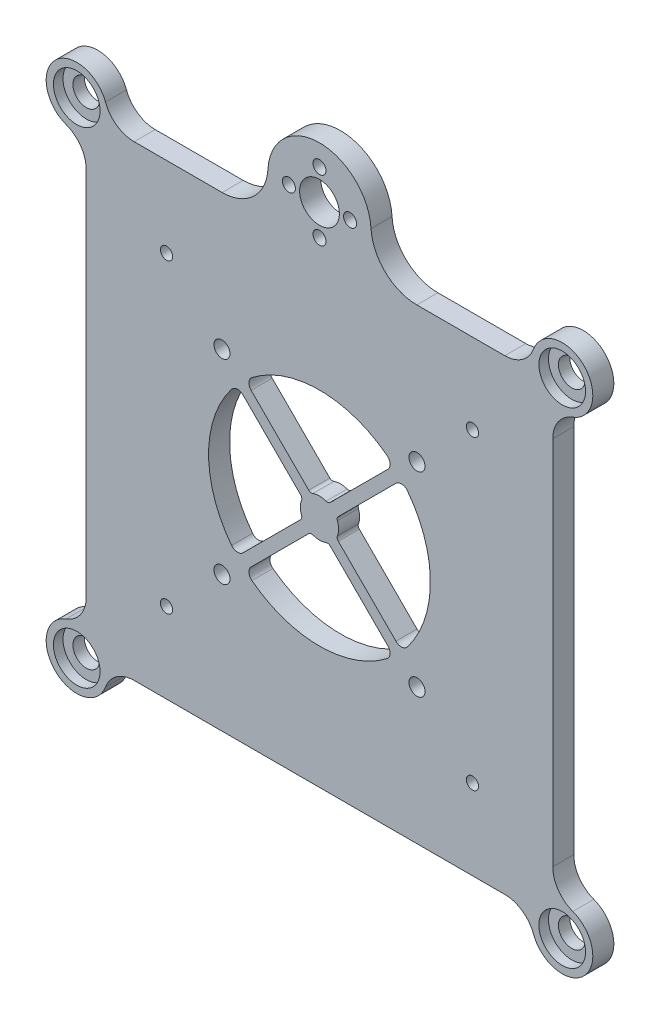
from build123d import *

# Parameters (mm, degrees)
EXTRUDE_1_DEPTH     = 5.5
SKETCH_2_R          = 6.1
CUT_EXTRUDE_1_DEPTH = 2.5
SKETCH_3_R          = 3.5
CUT_EXTRUDE_2_DEPTH = 3
SKETCH_4_R          = 1.7
CUT_EXTRUDE_3_DEPTH = 5.5
SKETCH_5_R          = 5.2
CUT_EXTRUDE_4_DEPTH = 5.5
SKETCH_6_R          = 1.6
SKETCH_6_R_2        = 2.1
CUT_EXTRUDE_5_DEPTH = 5.5
CUT_EXTRUDE_6_DEPTH = 10


with BuildPart() as part:
    # 草图1 → 凸台-拉伸1 (new body)
    with BuildSketch(Plane.XY):
        with BuildLine():
            Line((-48.459116019, -61), (48.459116019, -61))
            ThreePointArc((48.459116019, -61), (53.03620543, -62.438730875), (55.966994877, -66.237436867))
            ThreePointArc((55.966994877, -66.237436867), (69.131727984, -69.131727984), (66.237436867, -55.966994877))
            ThreePointArc((66.237436867, -55.966994877), (62.438730875, -53.03620543), (61, -48.459116019))
            Line((61, -48.459116019), (61, 48.459116019))
            ThreePointArc((61, 48.459116019), (62.438730875, 53.03620543), (66.237436867, 55.966994877))
            ThreePointArc((66.237436867, 55.966994877), (69.131727984, 69.131727984), (55.966994877, 66.237436867))
            ThreePointArc((55.966994877, 66.237436867), (53.03620543, 62.438730875), (48.459116019, 61))
            Line((48.459116019, 61), (25.455844123, 61))
            ThreePointArc((25.455844123, 61), (17.223912036, 64.268717499), (13.476623359, 72.294117647))
            ThreePointArc((13.476623359, 72.294117647), (0, 85), (-13.476623359, 72.294117647))
            ThreePointArc((-13.476623359, 72.294117647), (-17.223912036, 64.268717499), (-25.455844123, 61))
            Line((-25.455844123, 61), (-48.459116019, 61))
            ThreePointArc((-48.459116019, 61), (-53.03620543, 62.438730875), (-55.966994877, 66.237436867))
            ThreePointArc((-55.966994877, 66.237436867), (-69.131727984, 69.131727984), (-66.237436867, 55.966994877))
            ThreePointArc((-66.237436867, 55.966994877), (-62.438730875, 53.03620543), (-61, 48.459116019))
            Line((-61, 48.459116019), (-61, -48.459116019))
            ThreePointArc((-61, -48.459116019), (-62.438730875, -53.03620543), (-66.237436867, -55.966994877))
            ThreePointArc((-66.237436867, -55.966994877), (-69.131727984, -69.131727984), (-55.966994877, -66.237436867))
            ThreePointArc((-55.966994877, -66.237436867), (-53.03620543, -62.438730875), (-48.459116019, -61))
        make_face()
    extrude(amount=-EXTRUDE_1_DEPTH)

    # 草图2 → 切除-拉伸1 (cut)
    with BuildSketch(Plane.XY):
        with Locations((-63.474873734, 63.474873734)):
            Circle(SKETCH_2_R)
        with Locations((63.474873734, 63.474873734)):
            Circle(SKETCH_2_R)
        with Locations((63.474873734, -63.474873734)):
            Circle(SKETCH_2_R)
        with Locations((-63.474873734, -63.474873734)):
            Circle(SKETCH_2_R)
    extrude(amount=-CUT_EXTRUDE_1_DEPTH, mode=Mode.SUBTRACT)

    # 草图3 → 切除-拉伸2 (cut)
    with BuildSketch(Plane.XY.offset(-2.5)):
        with Locations((-63.474873734, 63.474873734)):
            Circle(SKETCH_3_R)
        with Locations((63.474873734, 63.474873734)):
            Circle(SKETCH_3_R)
        with Locations((-63.474873734, -63.474873734)):
            Circle(SKETCH_3_R)
        with Locations((63.474873734, -63.474873734)):
            Circle(SKETCH_3_R)
    extrude(amount=-CUT_EXTRUDE_2_DEPTH, mode=Mode.SUBTRACT)

    # 草图4 → 切除-拉伸3 (cut)
    with BuildSketch(Plane.XY):
        with Locations((8, 71.5)):
            Circle(SKETCH_4_R)
        with Locations((0, 79.5)):
            Circle(SKETCH_4_R)
        with Locations((-8, 71.5)):
            Circle(SKETCH_4_R)
        with Locations((0, 63.5)):
            Circle(SKETCH_4_R)
    extrude(amount=-CUT_EXTRUDE_3_DEPTH, mode=Mode.SUBTRACT)

    # 草图5 → 切除-拉伸4 (cut)
    with BuildSketch(Plane.XY):
        with Locations((0, 71.5)):
            Circle(SKETCH_5_R)
    extrude(amount=-CUT_EXTRUDE_4_DEPTH, mode=Mode.SUBTRACT)

    # 草图6 → 切除-拉伸5 (cut)
    with BuildSketch(Plane.XY):
        with Locations((-40, 40)):
            Circle(SKETCH_6_R)
        with Locations((40, 40)):
            Circle(SKETCH_6_R)
        with Locations((40, -40)):
            Circle(SKETCH_6_R)
        with Locations((-40, -40)):
            Circle(SKETCH_6_R)
        with Locations((-25.5, 25.5)):
            Circle(SKETCH_6_R_2)
        with Locations((25.5, 25.5)):
            Circle(SKETCH_6_R_2)
        with Locations((25.5, -25.5)):
            Circle(SKETCH_6_R_2)
        with Locations((-25.5, -25.5)):
            Circle(SKETCH_6_R_2)
    extrude(amount=-CUT_EXTRUDE_5_DEPTH, mode=Mode.SUBTRACT)

    # 草图8 → 切除-拉伸6 (cut)
    with BuildSketch(Plane.XY):
        with BuildLine():
            Line((4.917472327, 2.796151983), (19.991455189, 17.870134846))
            ThreePointArc((19.991455189, 17.870134846), (21.535572688, 18.451698066), (22.991273845, 17.674878416))
            ThreePointArc((22.991273845, 17.674878416), (29, 0), (22.991273845, -17.674878416))
            ThreePointArc((22.991273845, -17.674878416), (21.535572688, -18.451698066), (19.991455189, -17.870134846))
            Line((19.991455189, -17.870134846), (4.917472327, -2.796151983))
            ThreePointArc((4.917472327, -2.796151983), (4.647578764, -2.30228293), (4.687149257, -1.740871002))
            ThreePointArc((4.687149257, -1.740871002), (5, 0), (4.687149257, 1.740871002))
            ThreePointArc((4.687149257, 1.740871002), (4.647578764, 2.30228293), (4.917472327, 2.796151983))
        make_face()
        with BuildLine():
            Line((2.796151983, 4.917472327), (17.870134846, 19.991455189))
            ThreePointArc((17.870134846, 19.991455189), (18.451698066, 21.535572688), (17.674878416, 22.991273845))
            ThreePointArc((17.674878416, 22.991273845), (0, 29), (-17.674878416, 22.991273845))
            ThreePointArc((-17.674878416, 22.991273845), (-18.451698066, 21.535572688), (-17.870134846, 19.991455189))
            Line((-17.870134846, 19.991455189), (-2.796151983, 4.917472327))
            ThreePointArc((-2.796151983, 4.917472327), (-2.30228293, 4.647578764), (-1.740871002, 4.687149257))
            ThreePointArc((-1.740871002, 4.687149257), (0, 5), (1.740871002, 4.687149257))
            ThreePointArc((1.740871002, 4.687149257), (2.30228293, 4.647578764), (2.796151983, 4.917472327))
        make_face()
        with BuildLine():
            Line((-4.917472327, 2.796151983), (-19.991455189, 17.870134846))
            ThreePointArc((-19.991455189, 17.870134846), (-21.535572688, 18.451698066), (-22.991273845, 17.674878416))
            ThreePointArc((-22.991273845, 17.674878416), (-29, 0), (-22.991273845, -17.674878416))
            ThreePointArc((-22.991273845, -17.674878416), (-21.535572688, -18.451698066), (-19.991455189, -17.870134846))
            Line((-19.991455189, -17.870134846), (-4.917472327, -2.796151983))
            ThreePointArc((-4.917472327, -2.796151983), (-4.647578764, -2.30228293), (-4.687149257, -1.740871002))
            ThreePointArc((-4.687149257, -1.740871002), (-5, 0), (-4.687149257, 1.740871002))
            ThreePointArc((-4.687149257, 1.740871002), (-4.647578764, 2.30228293), (-4.917472327, 2.796151983))
        make_face()
        with BuildLine():
            Line((2.796151983, -4.917472327), (17.870134846, -19.991455189))
            ThreePointArc((17.870134846, -19.991455189), (18.451698066, -21.535572688), (17.674878416, -22.991273845))
            ThreePointArc((17.674878416, -22.991273845), (0, -29), (-17.674878416, -22.991273845))
            ThreePointArc((-17.674878416, -22.991273845), (-18.451698066, -21.535572688), (-17.870134846, -19.991455189))
            Line((-17.870134846, -19.991455189), (-2.796151983, -4.917472327))
            ThreePointArc((-2.796151983, -4.917472327), (-2.30228293, -4.647578764), (-1.740871002, -4.687149257))
            ThreePointArc((-1.740871002, -4.687149257), (0, -5), (1.740871002, -4.687149257))
            ThreePointArc((1.740871002, -4.687149257), (2.30228293, -4.647578764), (2.796151983, -4.917472327))
        make_face()
    extrude(amount=-CUT_EXTRUDE_6_DEPTH, mode=Mode.SUBTRACT)


solid = part.part
